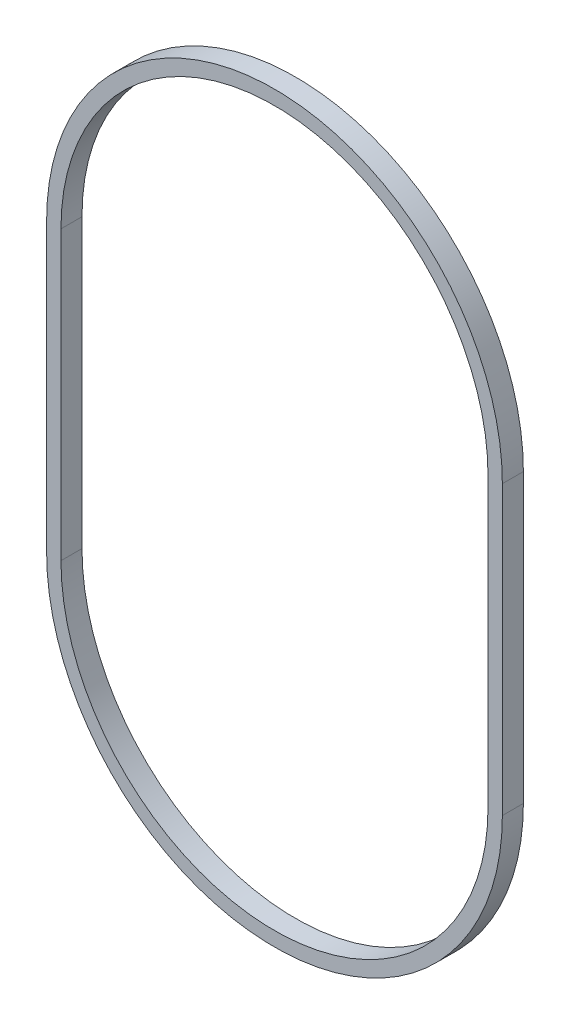
from build123d import *

# Parameters (mm, degrees)
BOSS_EXTRUDE1_DEPTH = 2.2


with BuildPart() as part:
    # Sketch1 → Boss-Extrude1 (new body)
    with BuildSketch(Plane.XY):
        with BuildLine():
            Line((-23.85, -15.04), (-23.85, 15.04))
            ThreePointArc((-23.85, 15.04), (0, 38.89), (23.85, 15.04))
            Line((23.85, 15.04), (23.85, -15.04))
            ThreePointArc((23.85, -15.04), (0, -38.89), (-23.85, -15.04))
        make_face()
        with BuildLine():
            Line((-22.35, -15.04), (-22.35, 15.04))
            ThreePointArc((-22.35, 15.04), (0, 37.39), (22.35, 15.04))
            Line((22.35, 15.04), (22.35, -15.04))
            ThreePointArc((22.35, -15.04), (0, -37.39), (-22.35, -15.04))
        make_face(mode=Mode.SUBTRACT)
    extrude(amount=BOSS_EXTRUDE1_DEPTH)


solid = part.part
